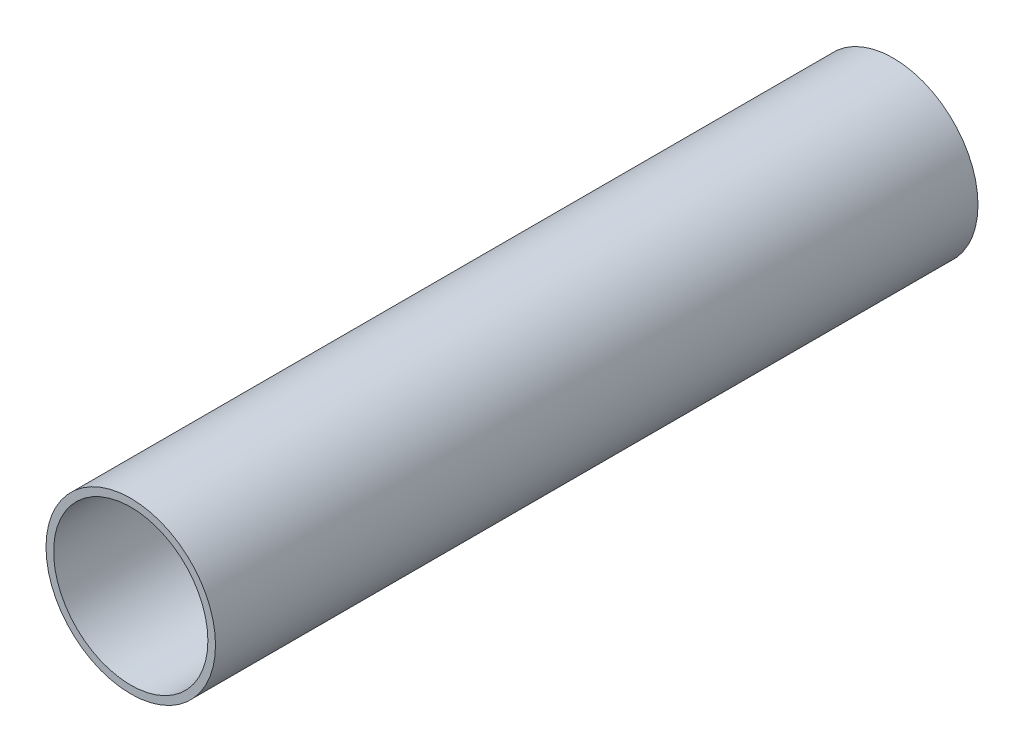
from build123d import *

# Parameters (mm, degrees)
ESBO_O1_R                = 22.23
ESBO_O1_R_2              = 20.23
RESSALTO_EXTRUS_O1_DEPTH = 200


with BuildPart() as part:
    # Esboço1 → Ressalto-extrusão1 (new body)
    with BuildSketch(Plane.XY):
        Circle(ESBO_O1_R)
        Circle(ESBO_O1_R_2, mode=Mode.SUBTRACT)
    extrude(amount=RESSALTO_EXTRUS_O1_DEPTH)


solid = part.part
